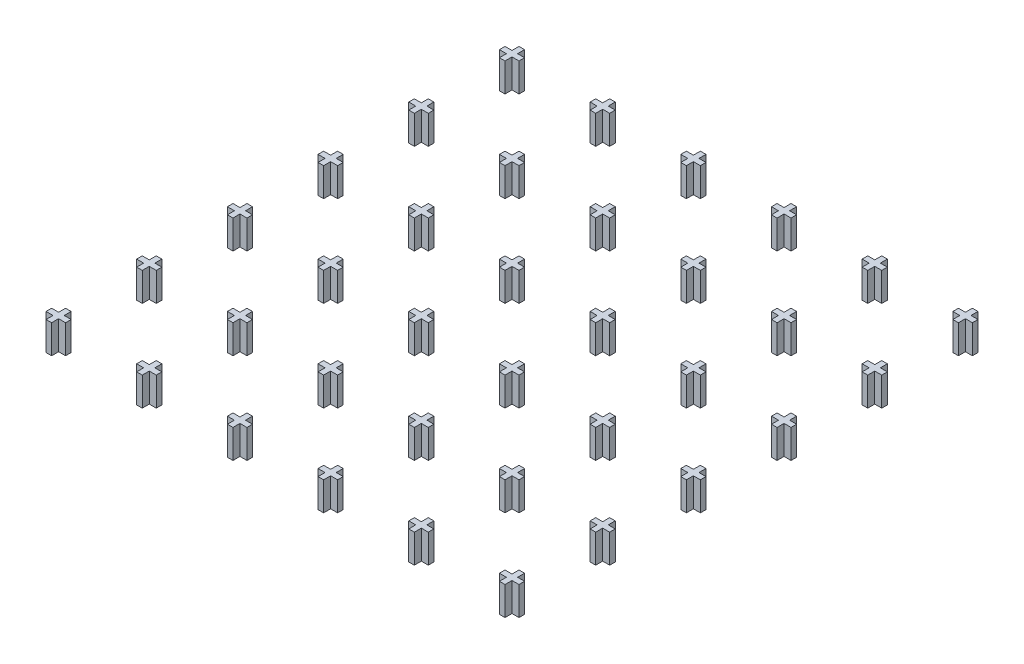
from build123d import *

# Parameters (mm, degrees)
BOSS_EXTRUDE1_DEPTH    = 6
BOSS_EXTRUDE1_2_DEPTH  = 6
BOSS_EXTRUDE1_3_DEPTH  = 6
BOSS_EXTRUDE1_4_DEPTH  = 6
BOSS_EXTRUDE1_5_DEPTH  = 6
BOSS_EXTRUDE1_6_DEPTH  = 6
BOSS_EXTRUDE1_7_DEPTH  = 6
BOSS_EXTRUDE1_8_DEPTH  = 6
BOSS_EXTRUDE1_9_DEPTH  = 6
BOSS_EXTRUDE1_10_DEPTH = 6
BOSS_EXTRUDE1_11_DEPTH = 6
BOSS_EXTRUDE1_12_DEPTH = 6
BOSS_EXTRUDE1_13_DEPTH = 6
BOSS_EXTRUDE1_14_DEPTH = 6
BOSS_EXTRUDE1_15_DEPTH = 6
BOSS_EXTRUDE1_16_DEPTH = 6
BOSS_EXTRUDE1_17_DEPTH = 6
BOSS_EXTRUDE1_18_DEPTH = 6
BOSS_EXTRUDE1_19_DEPTH = 6
BOSS_EXTRUDE1_20_DEPTH = 6
BOSS_EXTRUDE1_21_DEPTH = 6
BOSS_EXTRUDE1_22_DEPTH = 6
BOSS_EXTRUDE1_23_DEPTH = 6
BOSS_EXTRUDE1_24_DEPTH = 6
BOSS_EXTRUDE1_25_DEPTH = 6
BOSS_EXTRUDE1_26_DEPTH = 6
BOSS_EXTRUDE1_27_DEPTH = 6
BOSS_EXTRUDE1_28_DEPTH = 6
BOSS_EXTRUDE1_29_DEPTH = 6
BOSS_EXTRUDE1_30_DEPTH = 6
BOSS_EXTRUDE1_31_DEPTH = 6
BOSS_EXTRUDE1_32_DEPTH = 6
BOSS_EXTRUDE1_33_DEPTH = 6
BOSS_EXTRUDE1_34_DEPTH = 6
BOSS_EXTRUDE1_35_DEPTH = 6
BOSS_EXTRUDE1_36_DEPTH = 6


with BuildPart() as part:
    # Sketch1 → Boss-Extrude1 (new body)
    with BuildSketch(Plane(origin=(0, 0, 0), x_dir=(1, 0, 0), z_dir=(0, 1, 0))):
        Polygon((-61.87264188, 22.127287386), (-60.70264188, 22.127287386), (-60.70264188, 20.662287386), (-59.23764188, 20.662287386), (-59.23764188, 19.492287386), (-60.70264188, 19.492287386), (-60.70264188, 18.027287386), (-61.87264188, 18.027287386), (-61.87264188, 19.492287386), (-63.33764188, 19.492287386), (-63.33764188, 20.662287386), (-61.87264188, 20.662287386), align=None)
    extrude(amount=BOSS_EXTRUDE1_DEPTH)


with BuildPart() as body_2:
    # Sketch1 → Boss-Extrude1 2 (new body)
    with BuildSketch(Plane(origin=(0, 0, 0), x_dir=(1, 0, 0), z_dir=(0, 1, 0))):
        Polygon((-61.87264188, 3.127287386), (-60.70264188, 3.127287386), (-60.70264188, 1.662287386), (-59.23764188, 1.662287386), (-59.23764188, 0.492287386), (-60.70264188, 0.492287386), (-60.70264188, -0.972712614), (-61.87264188, -0.972712614), (-61.87264188, 0.492287386), (-63.33764188, 0.492287386), (-63.33764188, 1.662287386), (-61.87264188, 1.662287386), align=None)
    extrude(amount=BOSS_EXTRUDE1_2_DEPTH)


with BuildPart() as body_3:
    # Sketch1 → Boss-Extrude1 3 (new body)
    with BuildSketch(Plane(origin=(0, 0, 0), x_dir=(1, 0, 0), z_dir=(0, 1, 0))):
        Polygon((-61.87264188, -15.872712614), (-60.70264188, -15.872712614), (-60.70264188, -17.337712614), (-59.23764188, -17.337712614), (-59.23764188, -18.507712614), (-60.70264188, -18.507712614), (-60.70264188, -19.972712614), (-61.87264188, -19.972712614), (-61.87264188, -18.507712614), (-63.33764188, -18.507712614), (-63.33764188, -17.337712614), (-61.87264188, -17.337712614), align=None)
    extrude(amount=BOSS_EXTRUDE1_3_DEPTH)


with BuildPart() as body_4:
    # Sketch1 → Boss-Extrude1 4 (new body)
    with BuildSketch(Plane(origin=(0, 0, 0), x_dir=(1, 0, 0), z_dir=(0, 1, 0))):
        Polygon((-42.87264188, -15.872712614), (-41.70264188, -15.872712614), (-41.70264188, -17.337712614), (-40.23764188, -17.337712614), (-40.23764188, -18.507712614), (-41.70264188, -18.507712614), (-41.70264188, -19.972712614), (-42.87264188, -19.972712614), (-42.87264188, -18.507712614), (-44.33764188, -18.507712614), (-44.33764188, -17.337712614), (-42.87264188, -17.337712614), align=None)
    extrude(amount=BOSS_EXTRUDE1_4_DEPTH)


with BuildPart() as body_5:
    # Sketch1 → Boss-Extrude1 5 (new body)
    with BuildSketch(Plane(origin=(0, 0, 0), x_dir=(1, 0, 0), z_dir=(0, 1, 0))):
        Polygon((-42.87264188, 3.127287386), (-41.70264188, 3.127287386), (-41.70264188, 1.662287386), (-40.23764188, 1.662287386), (-40.23764188, 0.492287386), (-41.70264188, 0.492287386), (-41.70264188, -0.972712614), (-42.87264188, -0.972712614), (-42.87264188, 0.492287386), (-44.33764188, 0.492287386), (-44.33764188, 1.662287386), (-42.87264188, 1.662287386), align=None)
    extrude(amount=BOSS_EXTRUDE1_5_DEPTH)


with BuildPart() as body_6:
    # Sketch1 → Boss-Extrude1 6 (new body)
    with BuildSketch(Plane(origin=(0, 0, 0), x_dir=(1, 0, 0), z_dir=(0, 1, 0))):
        Polygon((-42.87264188, 22.127287386), (-41.70264188, 22.127287386), (-41.70264188, 20.662287386), (-40.23764188, 20.662287386), (-40.23764188, 19.492287386), (-41.70264188, 19.492287386), (-41.70264188, 18.027287386), (-42.87264188, 18.027287386), (-42.87264188, 19.492287386), (-44.33764188, 19.492287386), (-44.33764188, 20.662287386), (-42.87264188, 20.662287386), align=None)
    extrude(amount=BOSS_EXTRUDE1_6_DEPTH)


with BuildPart() as body_7:
    # Sketch1 → Boss-Extrude1 7 (new body)
    with BuildSketch(Plane(origin=(0, 0, 0), x_dir=(1, 0, 0), z_dir=(0, 1, 0))):
        Polygon((-23.87264188, 22.127287386), (-22.70264188, 22.127287386), (-22.70264188, 20.662287386), (-21.23764188, 20.662287386), (-21.23764188, 19.492287386), (-22.70264188, 19.492287386), (-22.70264188, 18.027287386), (-23.87264188, 18.027287386), (-23.87264188, 19.492287386), (-25.33764188, 19.492287386), (-25.33764188, 20.662287386), (-23.87264188, 20.662287386), align=None)
    extrude(amount=BOSS_EXTRUDE1_7_DEPTH)


with BuildPart() as body_8:
    # Sketch1 → Boss-Extrude1 8 (new body)
    with BuildSketch(Plane(origin=(0, 0, 0), x_dir=(1, 0, 0), z_dir=(0, 1, 0))):
        Polygon((-23.87264188, 3.127287386), (-22.70264188, 3.127287386), (-22.70264188, 1.662287386), (-21.23764188, 1.662287386), (-21.23764188, 0.492287386), (-22.70264188, 0.492287386), (-22.70264188, -0.972712614), (-23.87264188, -0.972712614), (-23.87264188, 0.492287386), (-25.33764188, 0.492287386), (-25.33764188, 1.662287386), (-23.87264188, 1.662287386), align=None)
    extrude(amount=BOSS_EXTRUDE1_8_DEPTH)


with BuildPart() as body_9:
    # Sketch1 → Boss-Extrude1 9 (new body)
    with BuildSketch(Plane(origin=(0, 0, 0), x_dir=(1, 0, 0), z_dir=(0, 1, 0))):
        Polygon((-23.87264188, -15.872712614), (-22.70264188, -15.872712614), (-22.70264188, -17.337712614), (-21.23764188, -17.337712614), (-21.23764188, -18.507712614), (-22.70264188, -18.507712614), (-22.70264188, -19.972712614), (-23.87264188, -19.972712614), (-23.87264188, -18.507712614), (-25.33764188, -18.507712614), (-25.33764188, -17.337712614), (-23.87264188, -17.337712614), align=None)
    extrude(amount=BOSS_EXTRUDE1_9_DEPTH)


with BuildPart() as body_10:
    # Sketch1 → Boss-Extrude1 10 (new body)
    with BuildSketch(Plane(origin=(0, 0, 0), x_dir=(1, 0, 0), z_dir=(0, 1, 0))):
        Polygon((-4.87264188, -15.872712614), (-3.70264188, -15.872712614), (-3.70264188, -17.337712614), (-2.23764188, -17.337712614), (-2.23764188, -18.507712614), (-3.70264188, -18.507712614), (-3.70264188, -19.972712614), (-4.87264188, -19.972712614), (-4.87264188, -18.507712614), (-6.33764188, -18.507712614), (-6.33764188, -17.337712614), (-4.87264188, -17.337712614), align=None)
    extrude(amount=BOSS_EXTRUDE1_10_DEPTH)


with BuildPart() as body_11:
    # Sketch1 → Boss-Extrude1 11 (new body)
    with BuildSketch(Plane(origin=(0, 0, 0), x_dir=(1, 0, 0), z_dir=(0, 1, 0))):
        Polygon((-4.87264188, 3.127287386), (-3.70264188, 3.127287386), (-3.70264188, 1.662287386), (-2.23764188, 1.662287386), (-2.23764188, 0.492287386), (-3.70264188, 0.492287386), (-3.70264188, -0.972712614), (-4.87264188, -0.972712614), (-4.87264188, 0.492287386), (-6.33764188, 0.492287386), (-6.33764188, 1.662287386), (-4.87264188, 1.662287386), align=None)
    extrude(amount=BOSS_EXTRUDE1_11_DEPTH)


with BuildPart() as body_12:
    # Sketch1 → Boss-Extrude1 12 (new body)
    with BuildSketch(Plane(origin=(0, 0, 0), x_dir=(1, 0, 0), z_dir=(0, 1, 0))):
        Polygon((-4.87264188, 22.127287386), (-3.70264188, 22.127287386), (-3.70264188, 20.662287386), (-2.23764188, 20.662287386), (-2.23764188, 19.492287386), (-3.70264188, 19.492287386), (-3.70264188, 18.027287386), (-4.87264188, 18.027287386), (-4.87264188, 19.492287386), (-6.33764188, 19.492287386), (-6.33764188, 20.662287386), (-4.87264188, 20.662287386), align=None)
    extrude(amount=BOSS_EXTRUDE1_12_DEPTH)


with BuildPart() as body_13:
    # Sketch1 → Boss-Extrude1 13 (new body)
    with BuildSketch(Plane(origin=(0, 0, 0), x_dir=(1, 0, 0), z_dir=(0, 1, 0))):
        Polygon((14.12735812, 22.127287386), (15.29735812, 22.127287386), (15.29735812, 20.662287386), (16.76235812, 20.662287386), (16.76235812, 19.492287386), (15.29735812, 19.492287386), (15.29735812, 18.027287386), (14.12735812, 18.027287386), (14.12735812, 19.492287386), (12.66235812, 19.492287386), (12.66235812, 20.662287386), (14.12735812, 20.662287386), align=None)
    extrude(amount=BOSS_EXTRUDE1_13_DEPTH)


with BuildPart() as body_14:
    # Sketch1 → Boss-Extrude1 14 (new body)
    with BuildSketch(Plane(origin=(0, 0, 0), x_dir=(1, 0, 0), z_dir=(0, 1, 0))):
        Polygon((14.12735812, 3.127287386), (15.29735812, 3.127287386), (15.29735812, 1.662287386), (16.76235812, 1.662287386), (16.76235812, 0.492287386), (15.29735812, 0.492287386), (15.29735812, -0.972712614), (14.12735812, -0.972712614), (14.12735812, 0.492287386), (12.66235812, 0.492287386), (12.66235812, 1.662287386), (14.12735812, 1.662287386), align=None)
    extrude(amount=BOSS_EXTRUDE1_14_DEPTH)


with BuildPart() as body_15:
    # Sketch1 → Boss-Extrude1 15 (new body)
    with BuildSketch(Plane(origin=(0, 0, 0), x_dir=(1, 0, 0), z_dir=(0, 1, 0))):
        Polygon((14.12735812, -15.872712614), (15.29735812, -15.872712614), (15.29735812, -17.337712614), (16.76235812, -17.337712614), (16.76235812, -18.507712614), (15.29735812, -18.507712614), (15.29735812, -19.972712614), (14.12735812, -19.972712614), (14.12735812, -18.507712614), (12.66235812, -18.507712614), (12.66235812, -17.337712614), (14.12735812, -17.337712614), align=None)
    extrude(amount=BOSS_EXTRUDE1_15_DEPTH)


with BuildPart() as body_16:
    # Sketch1 → Boss-Extrude1 16 (new body)
    with BuildSketch(Plane(origin=(0, 0, 0), x_dir=(1, 0, 0), z_dir=(0, 1, 0))):
        Polygon((33.12735812, -15.872712614), (34.29735812, -15.872712614), (34.29735812, -17.337712614), (35.76235812, -17.337712614), (35.76235812, -18.507712614), (34.29735812, -18.507712614), (34.29735812, -19.972712614), (33.12735812, -19.972712614), (33.12735812, -18.507712614), (31.66235812, -18.507712614), (31.66235812, -17.337712614), (33.12735812, -17.337712614), align=None)
    extrude(amount=BOSS_EXTRUDE1_16_DEPTH)


with BuildPart() as body_17:
    # Sketch1 → Boss-Extrude1 17 (new body)
    with BuildSketch(Plane(origin=(0, 0, 0), x_dir=(1, 0, 0), z_dir=(0, 1, 0))):
        Polygon((33.12735812, 3.127287386), (34.29735812, 3.127287386), (34.29735812, 1.662287386), (35.76235812, 1.662287386), (35.76235812, 0.492287386), (34.29735812, 0.492287386), (34.29735812, -0.972712614), (33.12735812, -0.972712614), (33.12735812, 0.492287386), (31.66235812, 0.492287386), (31.66235812, 1.662287386), (33.12735812, 1.662287386), align=None)
    extrude(amount=BOSS_EXTRUDE1_17_DEPTH)


with BuildPart() as body_18:
    # Sketch1 → Boss-Extrude1 18 (new body)
    with BuildSketch(Plane(origin=(0, 0, 0), x_dir=(1, 0, 0), z_dir=(0, 1, 0))):
        Polygon((33.12735812, 22.127287386), (34.29735812, 22.127287386), (34.29735812, 20.662287386), (35.76235812, 20.662287386), (35.76235812, 19.492287386), (34.29735812, 19.492287386), (34.29735812, 18.027287386), (33.12735812, 18.027287386), (33.12735812, 19.492287386), (31.66235812, 19.492287386), (31.66235812, 20.662287386), (33.12735812, 20.662287386), align=None)
    extrude(amount=BOSS_EXTRUDE1_18_DEPTH)


with BuildPart() as body_19:
    # Sketch1 → Boss-Extrude1 19 (new body)
    with BuildSketch(Plane(origin=(0, 0, 0), x_dir=(1, 0, 0), z_dir=(0, 1, 0))):
        Polygon((-61.87264188, -34.872712614), (-60.70264188, -34.872712614), (-60.70264188, -36.337712614), (-59.23764188, -36.337712614), (-59.23764188, -37.507712614), (-60.70264188, -37.507712614), (-60.70264188, -38.972712614), (-61.87264188, -38.972712614), (-61.87264188, -37.507712614), (-63.33764188, -37.507712614), (-63.33764188, -36.337712614), (-61.87264188, -36.337712614), align=None)
    extrude(amount=BOSS_EXTRUDE1_19_DEPTH)


with BuildPart() as body_20:
    # Sketch1 → Boss-Extrude1 20 (new body)
    with BuildSketch(Plane(origin=(0, 0, 0), x_dir=(1, 0, 0), z_dir=(0, 1, 0))):
        Polygon((-61.87264188, -53.872712614), (-60.70264188, -53.872712614), (-60.70264188, -55.337712614), (-59.23764188, -55.337712614), (-59.23764188, -56.507712614), (-60.70264188, -56.507712614), (-60.70264188, -57.972712614), (-61.87264188, -57.972712614), (-61.87264188, -56.507712614), (-63.33764188, -56.507712614), (-63.33764188, -55.337712614), (-61.87264188, -55.337712614), align=None)
    extrude(amount=BOSS_EXTRUDE1_20_DEPTH)


with BuildPart() as body_21:
    # Sketch1 → Boss-Extrude1 21 (new body)
    with BuildSketch(Plane(origin=(0, 0, 0), x_dir=(1, 0, 0), z_dir=(0, 1, 0))):
        Polygon((-61.87264188, -72.872712614), (-60.70264188, -72.872712614), (-60.70264188, -74.337712614), (-59.23764188, -74.337712614), (-59.23764188, -75.507712614), (-60.70264188, -75.507712614), (-60.70264188, -76.972712614), (-61.87264188, -76.972712614), (-61.87264188, -75.507712614), (-63.33764188, -75.507712614), (-63.33764188, -74.337712614), (-61.87264188, -74.337712614), align=None)
    extrude(amount=BOSS_EXTRUDE1_21_DEPTH)


with BuildPart() as body_22:
    # Sketch1 → Boss-Extrude1 22 (new body)
    with BuildSketch(Plane(origin=(0, 0, 0), x_dir=(1, 0, 0), z_dir=(0, 1, 0))):
        Polygon((-42.87264188, -72.872712614), (-41.70264188, -72.872712614), (-41.70264188, -74.337712614), (-40.23764188, -74.337712614), (-40.23764188, -75.507712614), (-41.70264188, -75.507712614), (-41.70264188, -76.972712614), (-42.87264188, -76.972712614), (-42.87264188, -75.507712614), (-44.33764188, -75.507712614), (-44.33764188, -74.337712614), (-42.87264188, -74.337712614), align=None)
    extrude(amount=BOSS_EXTRUDE1_22_DEPTH)


with BuildPart() as body_23:
    # Sketch1 → Boss-Extrude1 23 (new body)
    with BuildSketch(Plane(origin=(0, 0, 0), x_dir=(1, 0, 0), z_dir=(0, 1, 0))):
        Polygon((-42.87264188, -53.872712614), (-41.70264188, -53.872712614), (-41.70264188, -55.337712614), (-40.23764188, -55.337712614), (-40.23764188, -56.507712614), (-41.70264188, -56.507712614), (-41.70264188, -57.972712614), (-42.87264188, -57.972712614), (-42.87264188, -56.507712614), (-44.33764188, -56.507712614), (-44.33764188, -55.337712614), (-42.87264188, -55.337712614), align=None)
    extrude(amount=BOSS_EXTRUDE1_23_DEPTH)


with BuildPart() as body_24:
    # Sketch1 → Boss-Extrude1 24 (new body)
    with BuildSketch(Plane(origin=(0, 0, 0), x_dir=(1, 0, 0), z_dir=(0, 1, 0))):
        Polygon((-42.87264188, -34.872712614), (-41.70264188, -34.872712614), (-41.70264188, -36.337712614), (-40.23764188, -36.337712614), (-40.23764188, -37.507712614), (-41.70264188, -37.507712614), (-41.70264188, -38.972712614), (-42.87264188, -38.972712614), (-42.87264188, -37.507712614), (-44.33764188, -37.507712614), (-44.33764188, -36.337712614), (-42.87264188, -36.337712614), align=None)
    extrude(amount=BOSS_EXTRUDE1_24_DEPTH)


with BuildPart() as body_25:
    # Sketch1 → Boss-Extrude1 25 (new body)
    with BuildSketch(Plane(origin=(0, 0, 0), x_dir=(1, 0, 0), z_dir=(0, 1, 0))):
        Polygon((-23.87264188, -34.872712614), (-22.70264188, -34.872712614), (-22.70264188, -36.337712614), (-21.23764188, -36.337712614), (-21.23764188, -37.507712614), (-22.70264188, -37.507712614), (-22.70264188, -38.972712614), (-23.87264188, -38.972712614), (-23.87264188, -37.507712614), (-25.33764188, -37.507712614), (-25.33764188, -36.337712614), (-23.87264188, -36.337712614), align=None)
    extrude(amount=BOSS_EXTRUDE1_25_DEPTH)


with BuildPart() as body_26:
    # Sketch1 → Boss-Extrude1 26 (new body)
    with BuildSketch(Plane(origin=(0, 0, 0), x_dir=(1, 0, 0), z_dir=(0, 1, 0))):
        Polygon((-23.87264188, -53.872712614), (-22.70264188, -53.872712614), (-22.70264188, -55.337712614), (-21.23764188, -55.337712614), (-21.23764188, -56.507712614), (-22.70264188, -56.507712614), (-22.70264188, -57.972712614), (-23.87264188, -57.972712614), (-23.87264188, -56.507712614), (-25.33764188, -56.507712614), (-25.33764188, -55.337712614), (-23.87264188, -55.337712614), align=None)
    extrude(amount=BOSS_EXTRUDE1_26_DEPTH)


with BuildPart() as body_27:
    # Sketch1 → Boss-Extrude1 27 (new body)
    with BuildSketch(Plane(origin=(0, 0, 0), x_dir=(1, 0, 0), z_dir=(0, 1, 0))):
        Polygon((-23.87264188, -72.872712614), (-22.70264188, -72.872712614), (-22.70264188, -74.337712614), (-21.23764188, -74.337712614), (-21.23764188, -75.507712614), (-22.70264188, -75.507712614), (-22.70264188, -76.972712614), (-23.87264188, -76.972712614), (-23.87264188, -75.507712614), (-25.33764188, -75.507712614), (-25.33764188, -74.337712614), (-23.87264188, -74.337712614), align=None)
    extrude(amount=BOSS_EXTRUDE1_27_DEPTH)


with BuildPart() as body_28:
    # Sketch1 → Boss-Extrude1 28 (new body)
    with BuildSketch(Plane(origin=(0, 0, 0), x_dir=(1, 0, 0), z_dir=(0, 1, 0))):
        Polygon((-4.87264188, -72.872712614), (-3.70264188, -72.872712614), (-3.70264188, -74.337712614), (-2.23764188, -74.337712614), (-2.23764188, -75.507712614), (-3.70264188, -75.507712614), (-3.70264188, -76.972712614), (-4.87264188, -76.972712614), (-4.87264188, -75.507712614), (-6.33764188, -75.507712614), (-6.33764188, -74.337712614), (-4.87264188, -74.337712614), align=None)
    extrude(amount=BOSS_EXTRUDE1_28_DEPTH)


with BuildPart() as body_29:
    # Sketch1 → Boss-Extrude1 29 (new body)
    with BuildSketch(Plane(origin=(0, 0, 0), x_dir=(1, 0, 0), z_dir=(0, 1, 0))):
        Polygon((-4.87264188, -53.872712614), (-3.70264188, -53.872712614), (-3.70264188, -55.337712614), (-2.23764188, -55.337712614), (-2.23764188, -56.507712614), (-3.70264188, -56.507712614), (-3.70264188, -57.972712614), (-4.87264188, -57.972712614), (-4.87264188, -56.507712614), (-6.33764188, -56.507712614), (-6.33764188, -55.337712614), (-4.87264188, -55.337712614), align=None)
    extrude(amount=BOSS_EXTRUDE1_29_DEPTH)


with BuildPart() as body_30:
    # Sketch1 → Boss-Extrude1 30 (new body)
    with BuildSketch(Plane(origin=(0, 0, 0), x_dir=(1, 0, 0), z_dir=(0, 1, 0))):
        Polygon((-4.87264188, -34.872712614), (-3.70264188, -34.872712614), (-3.70264188, -36.337712614), (-2.23764188, -36.337712614), (-2.23764188, -37.507712614), (-3.70264188, -37.507712614), (-3.70264188, -38.972712614), (-4.87264188, -38.972712614), (-4.87264188, -37.507712614), (-6.33764188, -37.507712614), (-6.33764188, -36.337712614), (-4.87264188, -36.337712614), align=None)
    extrude(amount=BOSS_EXTRUDE1_30_DEPTH)


with BuildPart() as body_31:
    # Sketch1 → Boss-Extrude1 31 (new body)
    with BuildSketch(Plane(origin=(0, 0, 0), x_dir=(1, 0, 0), z_dir=(0, 1, 0))):
        Polygon((14.12735812, -34.872712614), (15.29735812, -34.872712614), (15.29735812, -36.337712614), (16.76235812, -36.337712614), (16.76235812, -37.507712614), (15.29735812, -37.507712614), (15.29735812, -38.972712614), (14.12735812, -38.972712614), (14.12735812, -37.507712614), (12.66235812, -37.507712614), (12.66235812, -36.337712614), (14.12735812, -36.337712614), align=None)
    extrude(amount=BOSS_EXTRUDE1_31_DEPTH)


with BuildPart() as body_32:
    # Sketch1 → Boss-Extrude1 32 (new body)
    with BuildSketch(Plane(origin=(0, 0, 0), x_dir=(1, 0, 0), z_dir=(0, 1, 0))):
        Polygon((14.12735812, -53.872712614), (15.29735812, -53.872712614), (15.29735812, -55.337712614), (16.76235812, -55.337712614), (16.76235812, -56.507712614), (15.29735812, -56.507712614), (15.29735812, -57.972712614), (14.12735812, -57.972712614), (14.12735812, -56.507712614), (12.66235812, -56.507712614), (12.66235812, -55.337712614), (14.12735812, -55.337712614), align=None)
    extrude(amount=BOSS_EXTRUDE1_32_DEPTH)


with BuildPart() as body_33:
    # Sketch1 → Boss-Extrude1 33 (new body)
    with BuildSketch(Plane(origin=(0, 0, 0), x_dir=(1, 0, 0), z_dir=(0, 1, 0))):
        Polygon((14.12735812, -72.872712614), (15.29735812, -72.872712614), (15.29735812, -74.337712614), (16.76235812, -74.337712614), (16.76235812, -75.507712614), (15.29735812, -75.507712614), (15.29735812, -76.972712614), (14.12735812, -76.972712614), (14.12735812, -75.507712614), (12.66235812, -75.507712614), (12.66235812, -74.337712614), (14.12735812, -74.337712614), align=None)
    extrude(amount=BOSS_EXTRUDE1_33_DEPTH)


with BuildPart() as body_34:
    # Sketch1 → Boss-Extrude1 34 (new body)
    with BuildSketch(Plane(origin=(0, 0, 0), x_dir=(1, 0, 0), z_dir=(0, 1, 0))):
        Polygon((33.12735812, -72.872712614), (34.29735812, -72.872712614), (34.29735812, -74.337712614), (35.76235812, -74.337712614), (35.76235812, -75.507712614), (34.29735812, -75.507712614), (34.29735812, -76.972712614), (33.12735812, -76.972712614), (33.12735812, -75.507712614), (31.66235812, -75.507712614), (31.66235812, -74.337712614), (33.12735812, -74.337712614), align=None)
    extrude(amount=BOSS_EXTRUDE1_34_DEPTH)


with BuildPart() as body_35:
    # Sketch1 → Boss-Extrude1 35 (new body)
    with BuildSketch(Plane(origin=(0, 0, 0), x_dir=(1, 0, 0), z_dir=(0, 1, 0))):
        Polygon((33.12735812, -53.872712614), (34.29735812, -53.872712614), (34.29735812, -55.337712614), (35.76235812, -55.337712614), (35.76235812, -56.507712614), (34.29735812, -56.507712614), (34.29735812, -57.972712614), (33.12735812, -57.972712614), (33.12735812, -56.507712614), (31.66235812, -56.507712614), (31.66235812, -55.337712614), (33.12735812, -55.337712614), align=None)
    extrude(amount=BOSS_EXTRUDE1_35_DEPTH)


with BuildPart() as body_36:
    # Sketch1 → Boss-Extrude1 36 (new body)
    with BuildSketch(Plane(origin=(0, 0, 0), x_dir=(1, 0, 0), z_dir=(0, 1, 0))):
        Polygon((33.12735812, -34.872712614), (34.29735812, -34.872712614), (34.29735812, -36.337712614), (35.76235812, -36.337712614), (35.76235812, -37.507712614), (34.29735812, -37.507712614), (34.29735812, -38.972712614), (33.12735812, -38.972712614), (33.12735812, -37.507712614), (31.66235812, -37.507712614), (31.66235812, -36.337712614), (33.12735812, -36.337712614), align=None)
    extrude(amount=BOSS_EXTRUDE1_36_DEPTH)


solid = Compound([part.part, body_2.part, body_3.part, body_4.part, body_5.part, body_6.part, body_7.part, body_8.part, body_9.part, body_10.part, body_11.part, body_12.part, body_13.part, body_14.part, body_15.part, body_16.part, body_17.part, body_18.part, body_19.part, body_20.part, body_21.part, body_22.part, body_23.part, body_24.part, body_25.part, body_26.part, body_27.part, body_28.part, body_29.part, body_30.part, body_31.part, body_32.part, body_33.part, body_34.part, body_35.part, body_36.part])
